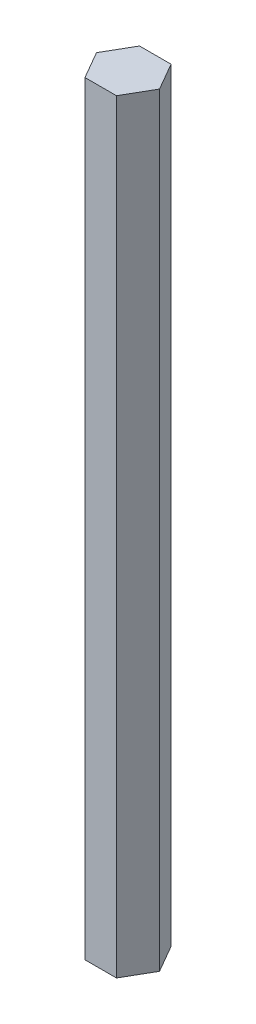
from build123d import *

# Parameters (mm, degrees)
BOSS_EXTRUDE1_DEPTH = 177.8


with BuildPart() as part:
    # Sketch1 → Boss-Extrude1 (new body)
    with BuildSketch(Plane(origin=(0, 0, 0), x_dir=(1, 0, 0), z_dir=(0, 1, 0))):
        Polygon((-7.332348419, 0), (-3.666174209, -6.35), (3.666174209, -6.35), (7.332348419, 0), (3.666174209, 6.35), (-3.666174209, 6.35), align=None)
    extrude(amount=BOSS_EXTRUDE1_DEPTH)


solid = part.part
